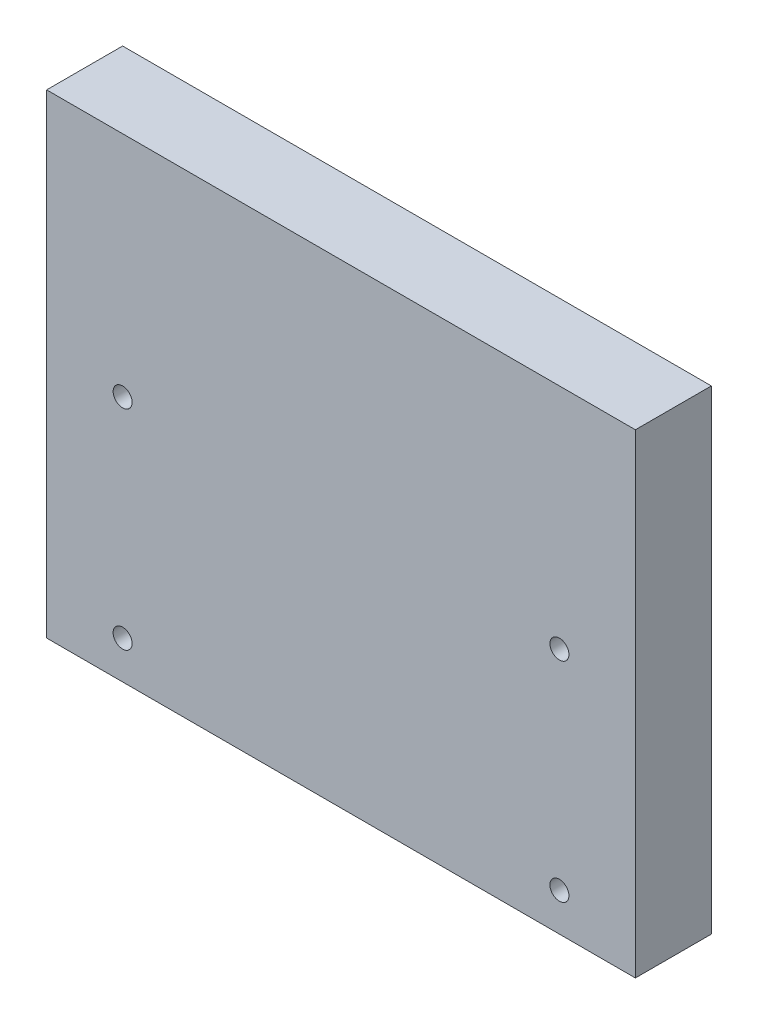
from build123d import *

# Parameters (mm, degrees)
ESQUISSE1_W        = 62
ESQUISSE1_H        = 50
ESQUISSE1_R        = 1
BOSS_EXTRU_1_DEPTH = 8


with BuildPart() as part:
    # Esquisse1 → Boss.-Extru.1 (new body)
    with BuildSketch(Plane.XY):
        with Locations((7.609796234, -0.224197121)):
            Rectangle(ESQUISSE1_W, ESQUISSE1_H)
        with Locations((-15.390203766, -21.224197121)):
            Circle(ESQUISSE1_R, mode=Mode.SUBTRACT)
        with Locations(Location((30.609796234, -21.224197121, 0), (0, 0, 180))):
            Circle(ESQUISSE1_R, mode=Mode.SUBTRACT)
        with Locations(Location((-15.390203766, 0.775802879, 0), (0, 0, 180))):
            Circle(ESQUISSE1_R, mode=Mode.SUBTRACT)
        with Locations((30.609796234, 0.775802879)):
            Circle(ESQUISSE1_R, mode=Mode.SUBTRACT)
    extrude(amount=BOSS_EXTRU_1_DEPTH)


solid = part.part
